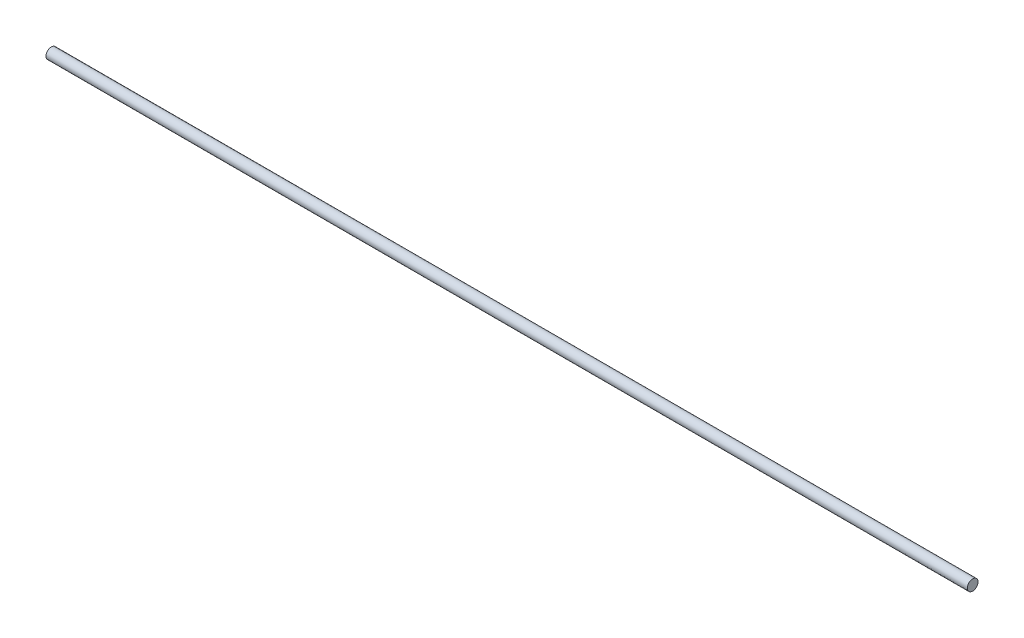
from build123d import *

# Parameters (mm, degrees)
SKETCH_1_R      = 2.5
EXTRUDE_1_DEPTH = 431.8


with BuildPart() as part:
    # 草图1 → 凸台-拉伸1 (new body)
    with BuildSketch(Plane(origin=(0, 0, 0), x_dir=(0, 0, -1), z_dir=(1, 0, 0))):
        Circle(SKETCH_1_R)
    extrude(amount=EXTRUDE_1_DEPTH)


solid = part.part
